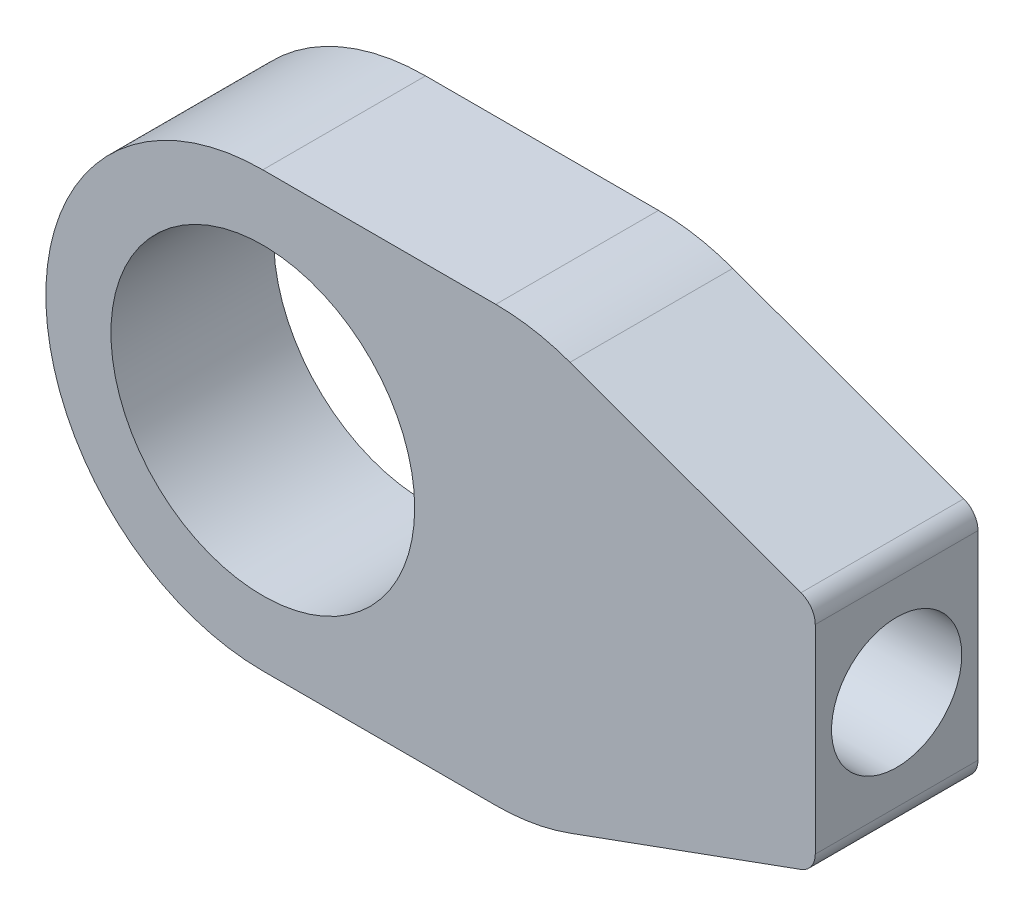
from build123d import *

# Parameters (mm, degrees)
SKETCH1_R           = 7
BOSS_EXTRUDE1_DEPTH = 7.5
SKETCH2_R           = 3
CUT_EXTRUDE1_DEPTH  = 10


with BuildPart() as part:
    # Sketch1 → Boss-Extrude1 (new body)
    with BuildSketch(Plane.XY):
        with BuildLine():
            Line((25.460451105, -4.582574037), (25.460451105, 4.582574037))
            ThreePointArc((25.460451105, 4.582574037), (25.279603149, 5.156150473), (24.802471248, 5.522266658))
            Line((24.802471248, 5.522266658), (14.156931626, 9.396926208))
            ThreePointArc((14.156931626, 9.396926208), (12.47321197, 9.84807753), (10.736730193, 10))
            Line((10.736730193, 10), (0, 10))
            ThreePointArc((0, 10), (-10, 0), (0, -10))
            Line((0, -10), (10.736730193, -10))
            ThreePointArc((10.736730193, -10), (12.47321197, -9.84807753), (14.156931626, -9.396926208))
            Line((14.156931626, -9.396926208), (24.802471248, -5.522266658))
            ThreePointArc((24.802471248, -5.522266658), (25.279603149, -5.156150473), (25.460451105, -4.582574037))
        make_face()
        Circle(SKETCH1_R, mode=Mode.SUBTRACT)
    extrude(amount=BOSS_EXTRUDE1_DEPTH)

    # Sketch2 → Cut-Extrude1 (cut)
    with BuildSketch(Plane(origin=(25.460451105, 0, 0), x_dir=(0, 0, -1), z_dir=(1, 0, 0))):
        with Locations((-3.75, 0)):
            Circle(SKETCH2_R)
    extrude(amount=-CUT_EXTRUDE1_DEPTH, mode=Mode.SUBTRACT)


solid = part.part
